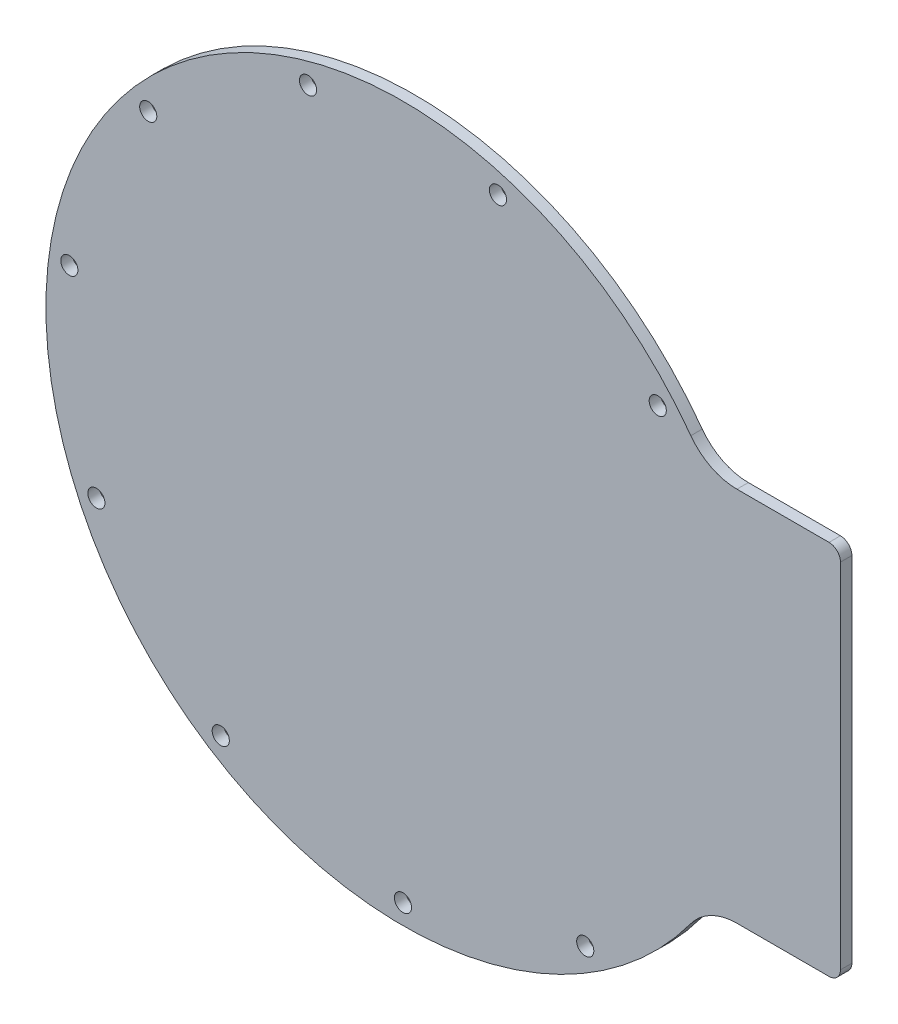
from build123d import *

# Parameters (mm, degrees)
SKETCH_1_R      = 1.5
EXTRUDE_1_DEPTH = 2


with BuildPart() as part:
    # 草图1 → 凸台-拉伸1 (new body)
    with BuildSketch(Plane.XY):
        with BuildLine():
            Line((58.445187997, 32.9), (74.5685, 32.9))
            ThreePointArc((74.5685, 32.9), (75.982713562, 32.314213562), (76.5685, 30.9))
            Line((76.5685, 30.9), (76.5685, -30.9))
            ThreePointArc((76.5685, -30.9), (75.982713562, -32.314213562), (74.5685, -32.9))
            Line((74.5685, -32.9), (58.445187997, -32.9))
            ThreePointArc((58.445187997, -32.9), (53.927025417, -33.978889817), (50.383782756, -36.982758621))
            ThreePointArc((50.383782756, -36.982758621), (-62.5, 0), (50.383782756, 36.982758621))
            ThreePointArc((50.383782756, 36.982758621), (53.927025417, 33.978889817), (58.445187997, 32.9))
        make_face()
        with Locations((0, -59)):
            Circle(SKETCH_1_R, mode=Mode.SUBTRACT)
        with Locations((-31.89780823, -49.633958437)):
            Circle(SKETCH_1_R, mode=Mode.SUBTRACT)
        with Locations((-53.668287726, -24.509485767)):
            Circle(SKETCH_1_R, mode=Mode.SUBTRACT)
        with Locations((-58.399465071, 8.396575458)):
            Circle(SKETCH_1_R, mode=Mode.SUBTRACT)
        with Locations((-44.589224887, 38.636783303)):
            Circle(SKETCH_1_R, mode=Mode.SUBTRACT)
        with Locations((-16.622220854, 56.610085443)):
            Circle(SKETCH_1_R, mode=Mode.SUBTRACT)
        with Locations((16.622220854, 56.610085443)):
            Circle(SKETCH_1_R, mode=Mode.SUBTRACT)
        with Locations((44.589224887, 38.636783303)):
            Circle(SKETCH_1_R, mode=Mode.SUBTRACT)
        with Locations((31.89780823, -49.633958437)):
            Circle(SKETCH_1_R, mode=Mode.SUBTRACT)
    extrude(amount=EXTRUDE_1_DEPTH)


solid = part.part
